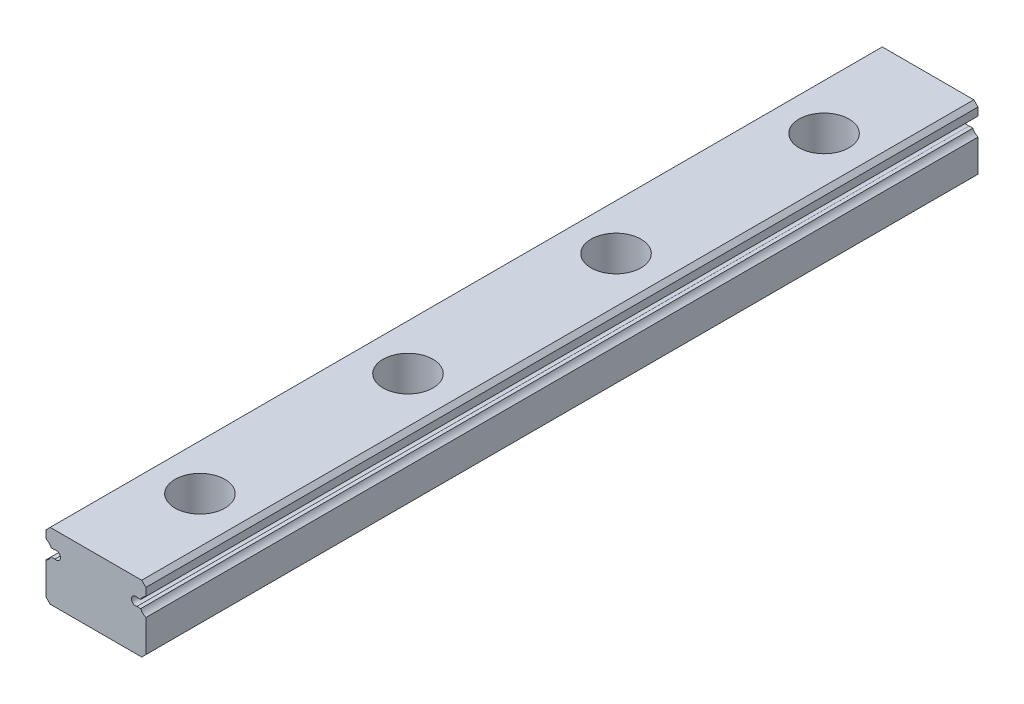
from build123d import *

# Parameters (mm, degrees)
BOSS_EXTRUDE1_DEPTH = 100
SKETCH2_R           = 3
CUT_EXTRUDE1_DEPTH  = 4.5
SKETCH3_R           = 1.75
CUT_EXTRUDE2_DEPTH  = 101.280855601
LPATTERN1_COUNT     = 4
LPATTERN1_PITCH     = 25


with BuildPart() as part:
    # Sketch1 → Boss-Extrude1 (new body)
    with BuildSketch(Plane.XY):
        with BuildLine():
            Line((6, -3.5), (6, 0.368911094))
            ThreePointArc((6, 0.368911094), (5.63354293, 0.61854293), (5.383911094, 0.985))
            Line((5.383911094, 0.985), (4.92112495, 0.985))
            ThreePointArc((4.92112495, 0.985), (4.265, 1.46), (4.92112495, 1.935))
            Line((4.92112495, 1.935), (5.383911094, 1.935))
            ThreePointArc((5.383911094, 1.935), (5.63354293, 2.30145707), (6, 2.551088906))
            Line((6, 2.551088906), (6, 3.5))
            Line((6, 3.5), (5.5, 4))
            Line((5.5, 4), (-5.5, 4))
            Line((-5.5, 4), (-6, 3.5))
            Line((-6, 3.5), (-6, 2.551088906))
            ThreePointArc((-6, 2.551088906), (-5.63354293, 2.30145707), (-5.383911094, 1.935))
            Line((-5.383911094, 1.935), (-4.92112495, 1.935))
            ThreePointArc((-4.92112495, 1.935), (-4.265, 1.46), (-4.92112495, 0.985))
            Line((-4.92112495, 0.985), (-5.383911094, 0.985))
            ThreePointArc((-5.383911094, 0.985), (-5.63354293, 0.61854293), (-6, 0.368911094))
            Line((-6, 0.368911094), (-6, -3.5))
            Line((-6, -3.5), (-5.5, -4))
            Line((-5.5, -4), (5.5, -4))
            Line((5.5, -4), (6, -3.5))
        make_face()
    extrude(amount=BOSS_EXTRUDE1_DEPTH)

    # Sketch2 → Cut-Extrude1 (cut)
    with BuildSketch(Plane(origin=(0, 4, 0), x_dir=(1, 0, 0), z_dir=(0, 1, 0))):
        with Locations(Location((0, -12.5, 0), (0, 0, 180))):
            Circle(SKETCH2_R)
    cut_extrude1 = extrude(amount=-CUT_EXTRUDE1_DEPTH, mode=Mode.SUBTRACT)

    # Sketch3 → Cut-Extrude2 (cut, through all)
    with BuildSketch(Plane(origin=(0, -0.5, 0), x_dir=(1, 0, 0), z_dir=(0, 1, 0))):
        with Locations(Location((0, -12.5, 0), (0, 0, 180))):
            Circle(SKETCH3_R)
    cut_extrude2 = extrude(amount=-CUT_EXTRUDE2_DEPTH, mode=Mode.SUBTRACT)

    # LPattern1: Cut-Extrude1, Cut-Extrude2 ×4
    with Locations(*[(0, 0, i * LPATTERN1_PITCH) for i in range(1, LPATTERN1_COUNT)]):
        add(cut_extrude1, mode=Mode.SUBTRACT)
        add(cut_extrude2, mode=Mode.SUBTRACT)


solid = part.part
